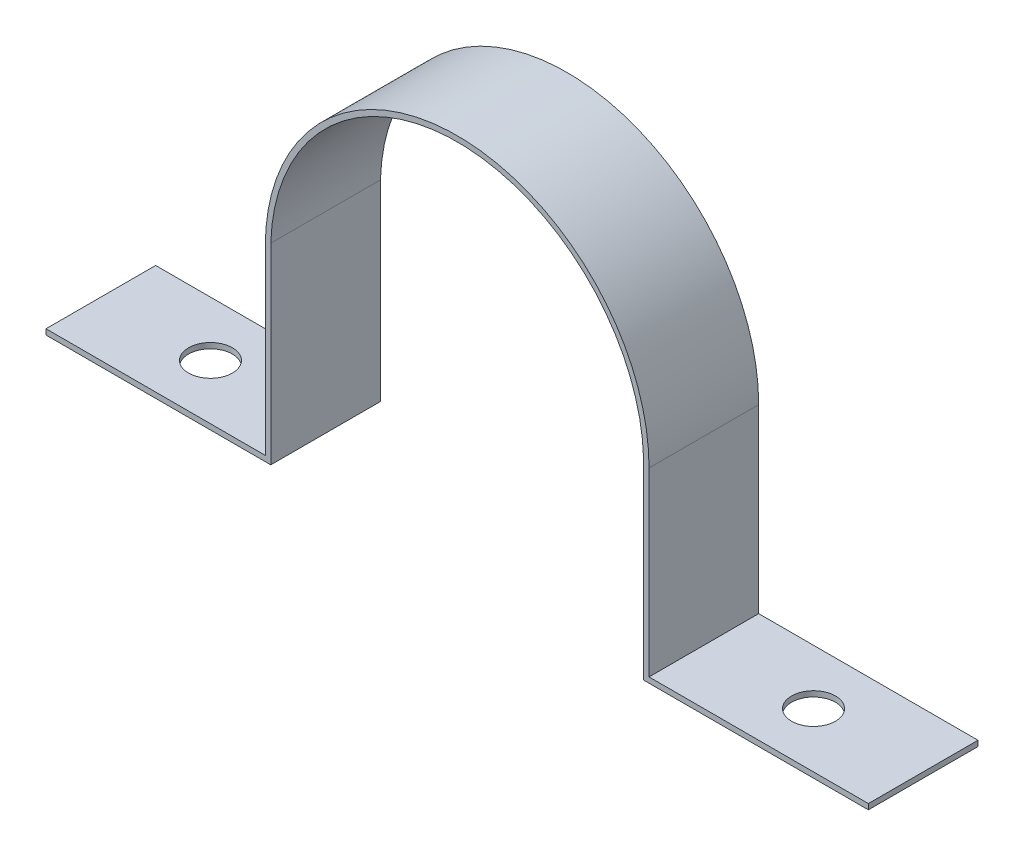
from build123d import *

# Parameters (mm, degrees)
SALIENTE_EXTRUIR1_DEPTH = 10
CROQUIS2_R              = 2
CORTAR_EXTRUIR1_DEPTH   = 10


with BuildPart() as part:
    # Croquis1 → Saliente-Extruir1 (new body)
    with BuildSketch(Plane.XY):
        with BuildLine():
            Line((-17.5, 0), (-17.5, -16.507351352))
            Line((-17.5, -16.507351352), (-37.5, -16.507351352))
            Line((-37.5, -16.507351352), (-37.5, -17.007351352))
            Line((-37.5, -17.007351352), (-17, -17.007351352))
            Line((-17, -17.007351352), (-17, 0.5))
            ThreePointArc((-17, 0.5), (0, 17.007351352), (17, 0.5))
            Line((17, 0.5), (17, -17.007351352))
            Line((17, -17.007351352), (37.5, -17.007351352))
            Line((37.5, -17.007351352), (37.5, -16.507351352))
            Line((37.5, -16.507351352), (17.5, -16.507351352))
            Line((17.5, -16.507351352), (17.5, 0))
            ThreePointArc((17.5, 0), (0, 17.5), (-17.5, 0))
        make_face()
    extrude(amount=SALIENTE_EXTRUIR1_DEPTH)

    # Croquis2 → Cortar-Extruir1 (cut)
    with BuildSketch(Plane(origin=(0, -16.507351352, 0), x_dir=(1, 0, 0), z_dir=(0, 1, 0))):
        with Locations(Location((-27.5, -5, 0), (0, 0, 270))):
            Circle(CROQUIS2_R)
        with Locations(Location((27.5, -5, 0), (0, 0, 270))):
            Circle(CROQUIS2_R)
    extrude(amount=-CORTAR_EXTRUIR1_DEPTH, mode=Mode.SUBTRACT)


solid = part.part
